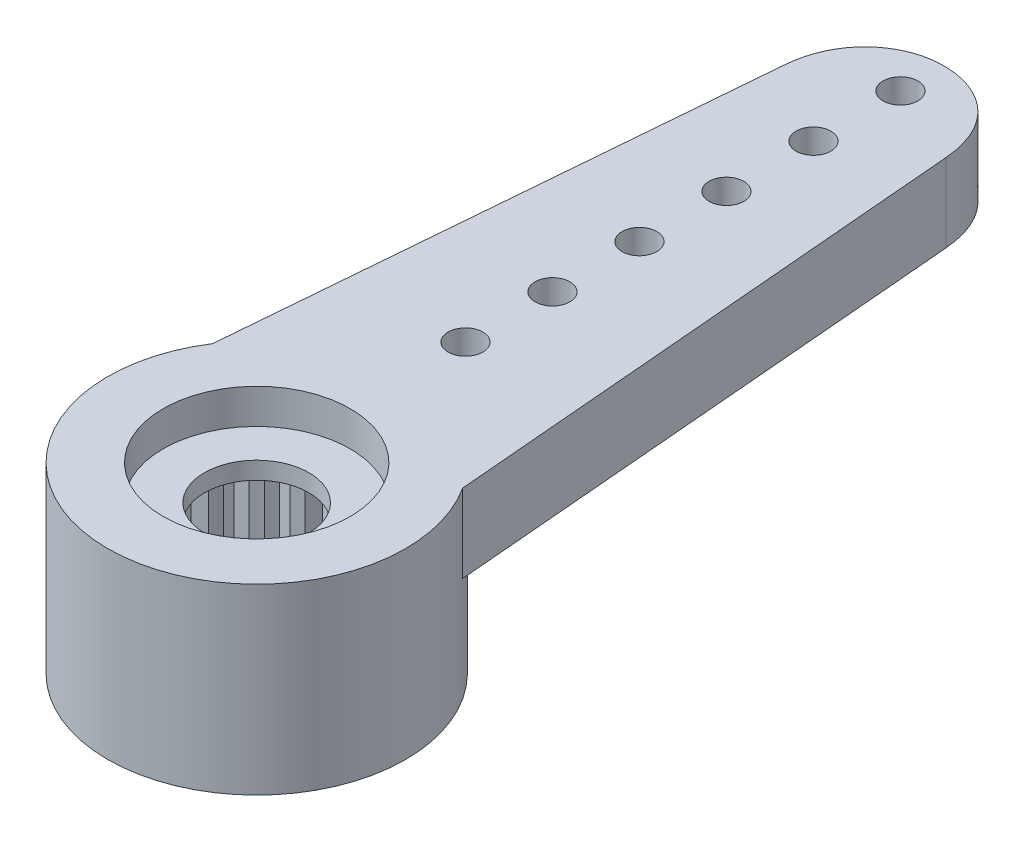
from build123d import *

# Parameters (mm, degrees)
SKETCH1_R           = 3.425
HUB_DEPTH           = 2.4
SKETCH2_R           = 0.4
BOSS_EXTRUDE2_DEPTH = 1.8
SKETCH3_R           = 2.15
CUT_EXTRUDE1_DEPTH  = 0.8
SKETCH4_R           = 1.2
CUT_EXTRUDE2_DEPTH  = 17.520612
CUT_EXTRUDE3_START  = -3
CUT_EXTRUDE3_DEPTH  = 3
CIRPATTERN1_COUNT   = 20
CUT_EXTRUDE4_START  = -3
SKETCH6_R           = 2.15
CUT_EXTRUDE4_DEPTH  = 3


with BuildPart() as part:
    # Sketch1 → HUB (new body)
    with BuildSketch(Plane(origin=(0, 0, 0), x_dir=(1, 0, 0), z_dir=(0, 1, 0))):
        with Locations(Location((0, 0, 0), (0, 0, 270))):
            Circle(SKETCH1_R)
    extrude(amount=HUB_DEPTH)

    # Sketch2 → Boss-Extrude2 (add)
    with BuildSketch(Plane(origin=(0, 2.4, 0), x_dir=(1, 0, 0), z_dir=(0, 1, 0))):
        with BuildLine():
            Line((-2.875, 1.861451), (-1.85, 14))
            add(Edge.make_bspline(
                [(-1.85, 14), (-1.761904, 15.043277), (-0.882336, 15.809649), (0.882387, 15.802355), (1.755744, 15.11622), (1.85, 14)],
                knots=[0, 0, 0, 0, 0.45, 0.55, 1, 1, 1, 1], degree=3))
            Line((1.85, 14), (2.875, 1.861451))
            ThreePointArc((2.875, 1.861451), (0, -3.425), (-2.875, 1.861451))
        make_face()
        with Locations(Location((0, 14.8, 0), (0, 0, 270))):
            Circle(SKETCH2_R, mode=Mode.SUBTRACT)
        with Locations(Location((0, 12.8, 0), (0, 0, 270))):
            Circle(SKETCH2_R, mode=Mode.SUBTRACT)
        with Locations(Location((0, 10.8, 0), (0, 0, 270))):
            Circle(SKETCH2_R, mode=Mode.SUBTRACT)
        with Locations(Location((0, 8.8, 0), (0, 0, 270))):
            Circle(SKETCH2_R, mode=Mode.SUBTRACT)
        with Locations(Location((0, 6.8, 0), (0, 0, 270))):
            Circle(SKETCH2_R, mode=Mode.SUBTRACT)
        with Locations(Location((0, 4.8, 0), (0, 0, 270))):
            Circle(SKETCH2_R, mode=Mode.SUBTRACT)
    extrude(amount=BOSS_EXTRUDE2_DEPTH)

    # Sketch3 → Cut-Extrude1 (cut)
    with BuildSketch(Plane(origin=(0, 4.2, 0), x_dir=(1, 0, 0), z_dir=(0, 1, 0))):
        with Locations(Location((0, 0, 0), (0, 0, 270))):
            Circle(SKETCH3_R)
    extrude(amount=-CUT_EXTRUDE1_DEPTH, mode=Mode.SUBTRACT)

    # Sketch4 → Cut-Extrude2 (cut, through all)
    with BuildSketch(Plane(origin=(0, 3.4, 0), x_dir=(1, 0, 0), z_dir=(0, 1, 0))):
        with Locations(Location((0, 0, 0), (0, 0, 270))):
            Circle(SKETCH4_R)
    extrude(amount=-CUT_EXTRUDE2_DEPTH, mode=Mode.SUBTRACT)

    # Sketch5 → Cut-Extrude3 (cut)
    with BuildSketch(Plane.XZ.offset(CUT_EXTRUDE3_START)):
        with BuildLine():
            Line((0, 2.35), (-0.210311, 2.139689))
            ThreePointArc((-0.210311, 2.139689), (0, 2.15), (0.210311, 2.139689))
            Line((0.210311, 2.139689), (0, 2.35))
        make_face()
    cut_extrude3 = extrude(amount=CUT_EXTRUDE3_DEPTH, mode=Mode.SUBTRACT)

    # CirPattern1: Cut-Extrude3 ×20 about axis
    cirpattern1_axis = Axis((0, 0, 0), (0, 1, 0))
    for i in range(1, CIRPATTERN1_COUNT):
        add(cut_extrude3.rotate(cirpattern1_axis, i * 360 / CIRPATTERN1_COUNT), mode=Mode.SUBTRACT)

    # Sketch6 → Cut-Extrude4 (cut)
    with BuildSketch(Plane.XZ.offset(CUT_EXTRUDE4_START)):
        with Locations(Location((0, 0, 0), (0, 0, 90))):
            Circle(SKETCH6_R)
    extrude(amount=CUT_EXTRUDE4_DEPTH, mode=Mode.SUBTRACT)


solid = part.part
